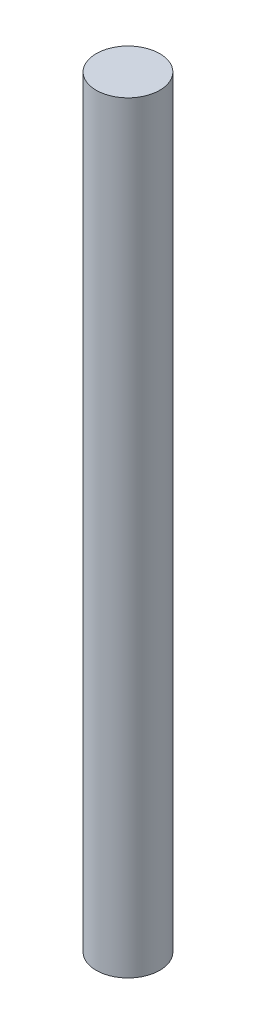
from build123d import *

# Parameters (mm, degrees)
SKETCH4_R           = 5
BOSS_EXTRUDE1_DEPTH = 120
SKETCH5_W           = 3.35
SKETCH5_H           = 17


with BuildPart() as part:
    # Sketch3 → Revolve1 (revolve)
    with BuildSketch(Plane.XY, mode=Mode.PRIVATE) as revolve1_sk:
        Polygon((0, 0), (2.7, 0), (3.35, 17), (0, 17), align=None)
    revolve(revolve1_sk.sketch.rotate(Axis((0, 17, 0), (0, -1, 0)), 180), axis=Axis((0, 17, 0), (0, -1, 0)))

    # Sketch4 → Boss-Extrude1 (add)
    with BuildSketch(Plane(origin=(0, 0, 0), x_dir=(1, 0, 0), z_dir=(0, 1, 0))):
        with Locations(Location((0, 0, 0), (0, 0, 270))):
            Circle(SKETCH4_R)
    extrude(amount=BOSS_EXTRUDE1_DEPTH)

    # Sketch5 → Cut-Revolve1 (revolve, cut)
    with BuildSketch(Plane.XY, mode=Mode.PRIVATE) as cut_revolve1_sk:
        with Locations((1.675, 8.5)):
            Rectangle(SKETCH5_W, SKETCH5_H)
    revolve(cut_revolve1_sk.sketch.rotate(Axis((0, 17, 0), (0, -1, 0)), 180), axis=Axis((0, 17, 0), (0, -1, 0)), mode=Mode.SUBTRACT)


solid = part.part
